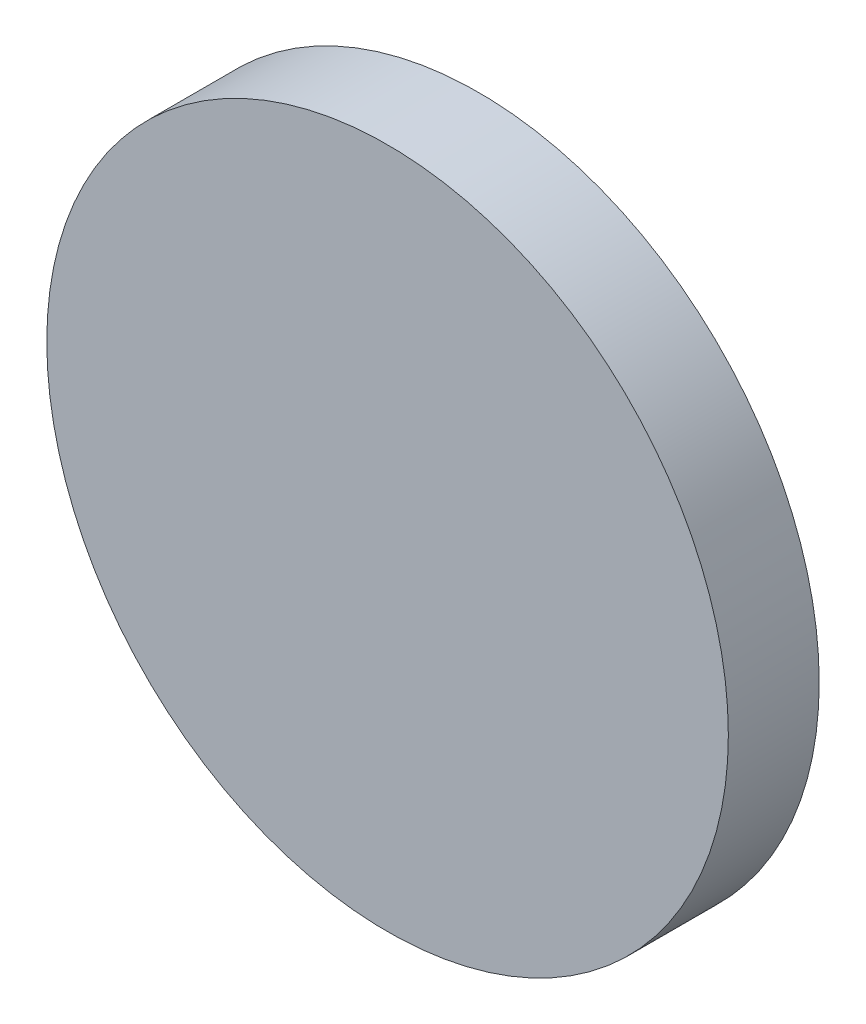
from build123d import *

# Parameters (mm, degrees)
SKETCH_1_R      = 60
EXTRUDE_1_DEPTH = 16


with BuildPart() as part:
    # 草图1 → 凸台-拉伸1 (new body)
    with BuildSketch(Plane.XY):
        Circle(SKETCH_1_R)
    extrude(amount=EXTRUDE_1_DEPTH)


solid = part.part
